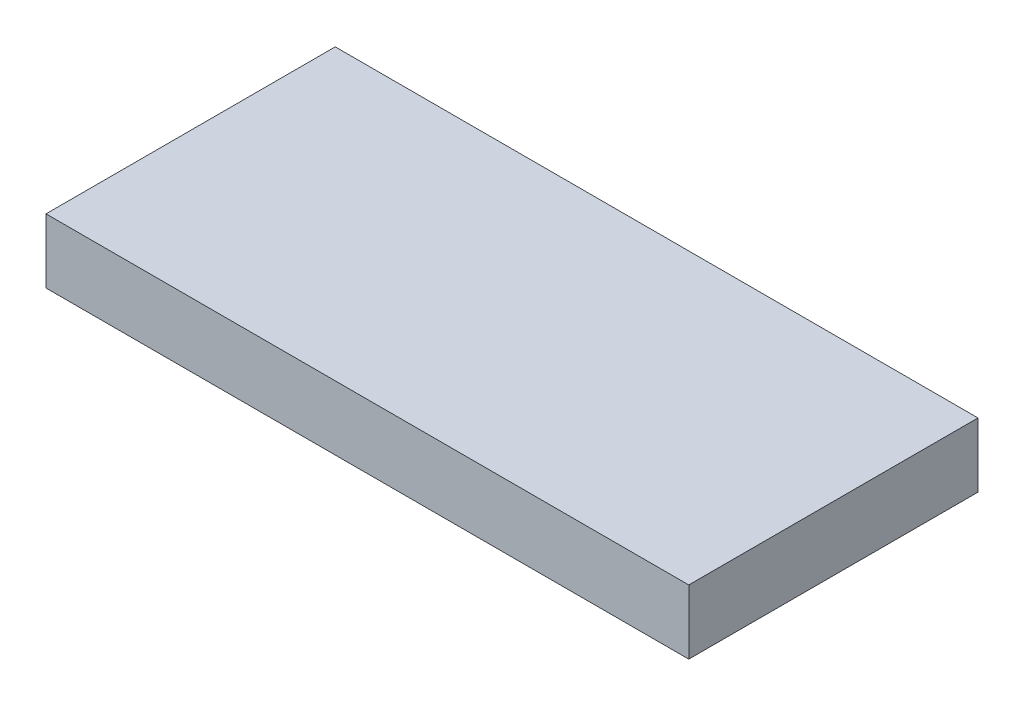
from build123d import *

# Parameters (mm, degrees)
SKETCH1_W           = 50.8
SKETCH1_H           = 22.86
BOSS_EXTRUDE1_DEPTH = 5.08


with BuildPart() as part:
    # Sketch1 → Boss-Extrude1 (new body)
    with BuildSketch(Plane(origin=(0, 0, 0), x_dir=(1, 0, 0), z_dir=(0, 1, 0))):
        with Locations((25.4, 11.43)):
            Rectangle(SKETCH1_W, SKETCH1_H)
    extrude(amount=BOSS_EXTRUDE1_DEPTH)


solid = part.part
